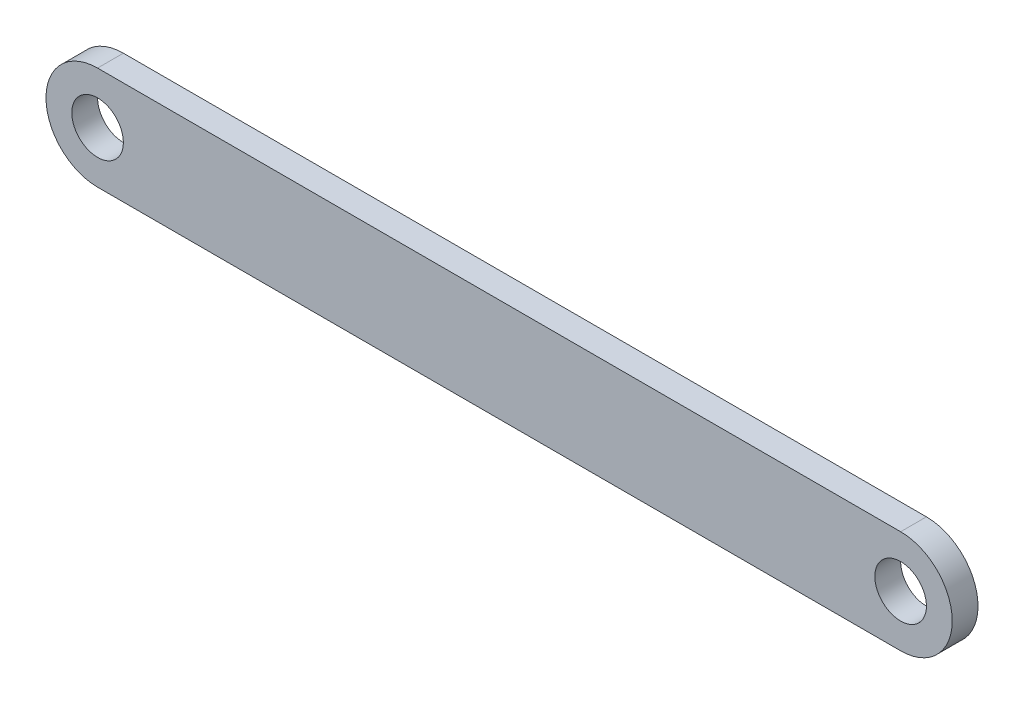
from build123d import *

# Parameters (mm, degrees)
SKETCH1_R           = 12.7
BOSS_EXTRUDE1_DEPTH = 6.35


with BuildPart() as part:
    # Sketch1 → Boss-Extrude1 (new, symmetric)
    with BuildSketch(Plane.XY):
        with BuildLine():
            Line((-197.739, 25.4), (197.739, 25.4))
            ThreePointArc((197.739, 25.4), (223.139, 0), (197.739, -25.4))
            Line((197.739, -25.4), (-197.739, -25.4))
            ThreePointArc((-197.739, -25.4), (-223.139, 0), (-197.739, 25.4))
        make_face()
        with Locations((-197.739, 0)):
            Circle(SKETCH1_R, mode=Mode.SUBTRACT)
        with Locations((197.739, 0)):
            Circle(SKETCH1_R, mode=Mode.SUBTRACT)
    extrude(amount=BOSS_EXTRUDE1_DEPTH, both=True)


solid = part.part
